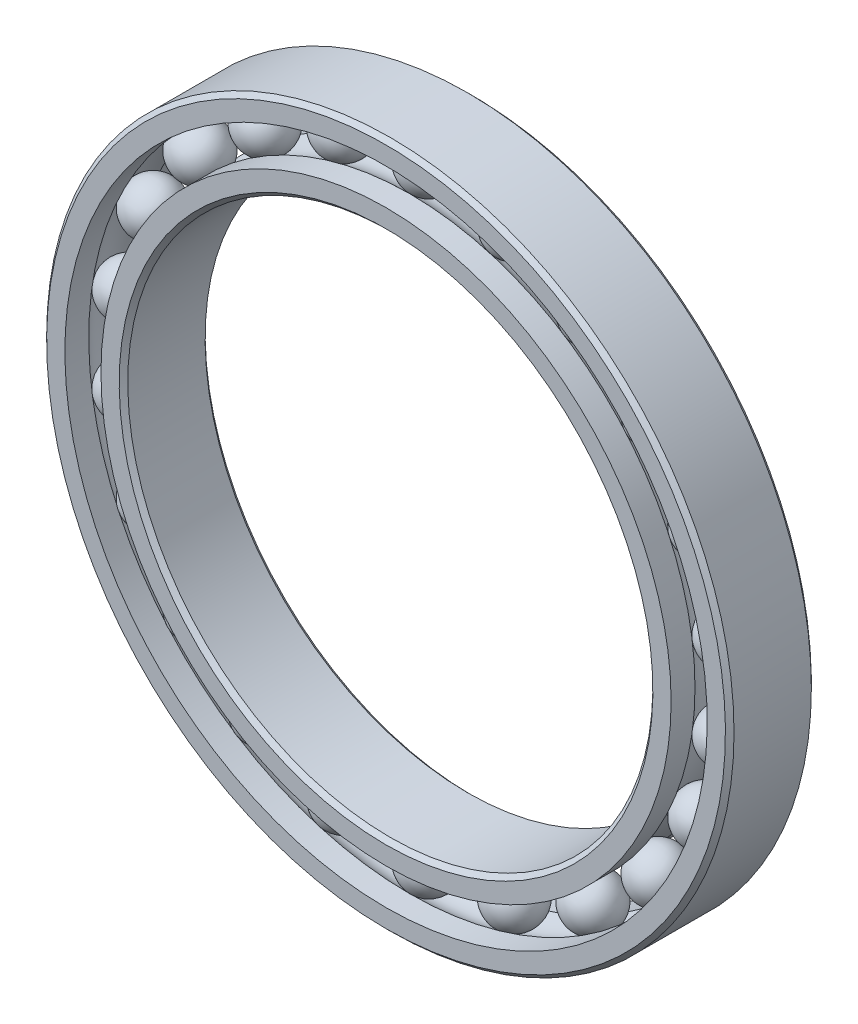
from build123d import *

# Parameters (mm, degrees)
CIRPATTERN1_COUNT = 22


with BuildPart() as part:
    # Sketch6 → Revolve5 (revolve)
    with BuildSketch(Plane(origin=(0, 0, 0), x_dir=(0, 0, -1), z_dir=(1, 0, 0)), mode=Mode.PRIVATE) as revolve5_sk:
        with BuildLine():
            Line((4.05, 36), (4.5, 35.55))
            Line((4.5, 35.55), (4.5, 33.638888889))
            Line((4.5, 33.638888889), (2, 33.638888889))
            ThreePointArc((2, 33.638888889), (0, 34.500981867), (-2, 33.638888889))
            Line((-2, 33.638888889), (-4.5, 33.638888889))
            Line((-4.5, 33.638888889), (-4.5, 35.55))
            Line((-4.5, 35.55), (-4.05, 36))
            Line((-4.05, 36), (4.05, 36))
        make_face()
    revolve(revolve5_sk.sketch.rotate(Axis((0, 0, 4.5), (0, 0, -1)), 180), axis=Axis((0, 0, 4.5), (0, 0, -1)))


with BuildPart() as body_2:
    # Sketch3 → Revolve3 (revolve)
    with BuildSketch(Plane(origin=(0, 0, 0), x_dir=(0, 0, -1), z_dir=(1, 0, 0)), mode=Mode.PRIVATE) as revolve3_sk:
        with BuildLine():
            Line((-4.5, 29.861111111), (-2, 29.861111111))
            ThreePointArc((-2, 29.861111111), (0, 28.999018133), (2, 29.861111111))
            Line((2, 29.861111111), (4.5, 29.861111111))
            Line((4.5, 29.861111111), (4.5, 27.95))
            Line((4.5, 27.95), (4.05, 27.5))
            Line((4.05, 27.5), (-4.05, 27.5))
            Line((-4.05, 27.5), (-4.5, 27.95))
            Line((-4.5, 27.95), (-4.5, 29.861111111))
        make_face()
    revolve(revolve3_sk.sketch.rotate(Axis((0, 0, 4.5), (0, 0, -1)), 180), axis=Axis((0, 0, 4.5), (0, 0, -1)))


with BuildPart() as body_3:
    # Sketch4 → Revolve4 (revolve)
    with BuildSketch(Plane(origin=(0, 0, 0), x_dir=(0, 0, -1), z_dir=(1, 0, 0))):
        with BuildLine():
            Line((-2.750981867, 31.75), (2.750981867, 31.75))
            ThreePointArc((2.750981867, 31.75), (0, 34.500981867), (-2.750981867, 31.75))
        make_face()
    revolve(axis=Axis((0, 31.75, 2.750981867), (0, 0, -1)))


with BuildPart() as cirpattern1_1:
    # CirPattern1: pattern copy
    add(body_3.part.rotate(Axis((0, 0, 0), (0, 0, 1)), 1 * 360 / CIRPATTERN1_COUNT))


with BuildPart() as cirpattern1_2:
    # CirPattern1: pattern copy
    add(body_3.part.rotate(Axis((0, 0, 0), (0, 0, 1)), 2 * 360 / CIRPATTERN1_COUNT))


with BuildPart() as cirpattern1_3:
    # CirPattern1: pattern copy
    add(body_3.part.rotate(Axis((0, 0, 0), (0, 0, 1)), 3 * 360 / CIRPATTERN1_COUNT))


with BuildPart() as cirpattern1_4:
    # CirPattern1: pattern copy
    add(body_3.part.rotate(Axis((0, 0, 0), (0, 0, 1)), 4 * 360 / CIRPATTERN1_COUNT))


with BuildPart() as cirpattern1_5:
    # CirPattern1: pattern copy
    add(body_3.part.rotate(Axis((0, 0, 0), (0, 0, 1)), 5 * 360 / CIRPATTERN1_COUNT))


with BuildPart() as cirpattern1_6:
    # CirPattern1: pattern copy
    add(body_3.part.rotate(Axis((0, 0, 0), (0, 0, 1)), 6 * 360 / CIRPATTERN1_COUNT))


with BuildPart() as cirpattern1_7:
    # CirPattern1: pattern copy
    add(body_3.part.rotate(Axis((0, 0, 0), (0, 0, 1)), 7 * 360 / CIRPATTERN1_COUNT))


with BuildPart() as cirpattern1_8:
    # CirPattern1: pattern copy
    add(body_3.part.rotate(Axis((0, 0, 0), (0, 0, 1)), 8 * 360 / CIRPATTERN1_COUNT))


with BuildPart() as cirpattern1_9:
    # CirPattern1: pattern copy
    add(body_3.part.rotate(Axis((0, 0, 0), (0, 0, 1)), 9 * 360 / CIRPATTERN1_COUNT))


with BuildPart() as cirpattern1_10:
    # CirPattern1: pattern copy
    add(body_3.part.rotate(Axis((0, 0, 0), (0, 0, 1)), 10 * 360 / CIRPATTERN1_COUNT))


with BuildPart() as cirpattern1_11:
    # CirPattern1: pattern copy
    add(body_3.part.rotate(Axis((0, 0, 0), (0, 0, 1)), 11 * 360 / CIRPATTERN1_COUNT))


with BuildPart() as cirpattern1_12:
    # CirPattern1: pattern copy
    add(body_3.part.rotate(Axis((0, 0, 0), (0, 0, 1)), 12 * 360 / CIRPATTERN1_COUNT))


with BuildPart() as cirpattern1_13:
    # CirPattern1: pattern copy
    add(body_3.part.rotate(Axis((0, 0, 0), (0, 0, 1)), 13 * 360 / CIRPATTERN1_COUNT))


with BuildPart() as cirpattern1_14:
    # CirPattern1: pattern copy
    add(body_3.part.rotate(Axis((0, 0, 0), (0, 0, 1)), 14 * 360 / CIRPATTERN1_COUNT))


with BuildPart() as cirpattern1_15:
    # CirPattern1: pattern copy
    add(body_3.part.rotate(Axis((0, 0, 0), (0, 0, 1)), 15 * 360 / CIRPATTERN1_COUNT))


with BuildPart() as cirpattern1_16:
    # CirPattern1: pattern copy
    add(body_3.part.rotate(Axis((0, 0, 0), (0, 0, 1)), 16 * 360 / CIRPATTERN1_COUNT))


with BuildPart() as cirpattern1_17:
    # CirPattern1: pattern copy
    add(body_3.part.rotate(Axis((0, 0, 0), (0, 0, 1)), 17 * 360 / CIRPATTERN1_COUNT))


with BuildPart() as cirpattern1_18:
    # CirPattern1: pattern copy
    add(body_3.part.rotate(Axis((0, 0, 0), (0, 0, 1)), 18 * 360 / CIRPATTERN1_COUNT))


with BuildPart() as cirpattern1_19:
    # CirPattern1: pattern copy
    add(body_3.part.rotate(Axis((0, 0, 0), (0, 0, 1)), 19 * 360 / CIRPATTERN1_COUNT))


with BuildPart() as cirpattern1_20:
    # CirPattern1: pattern copy
    add(body_3.part.rotate(Axis((0, 0, 0), (0, 0, 1)), 20 * 360 / CIRPATTERN1_COUNT))


with BuildPart() as cirpattern1_21:
    # CirPattern1: pattern copy
    add(body_3.part.rotate(Axis((0, 0, 0), (0, 0, 1)), 21 * 360 / CIRPATTERN1_COUNT))


solid = Compound([part.part, body_2.part, body_3.part, cirpattern1_1.part, cirpattern1_2.part, cirpattern1_3.part, cirpattern1_4.part, cirpattern1_5.part, cirpattern1_6.part, cirpattern1_7.part, cirpattern1_8.part, cirpattern1_9.part, cirpattern1_10.part, cirpattern1_11.part, cirpattern1_12.part, cirpattern1_13.part, cirpattern1_14.part, cirpattern1_15.part, cirpattern1_16.part, cirpattern1_17.part, cirpattern1_18.part, cirpattern1_19.part, cirpattern1_20.part, cirpattern1_21.part])
